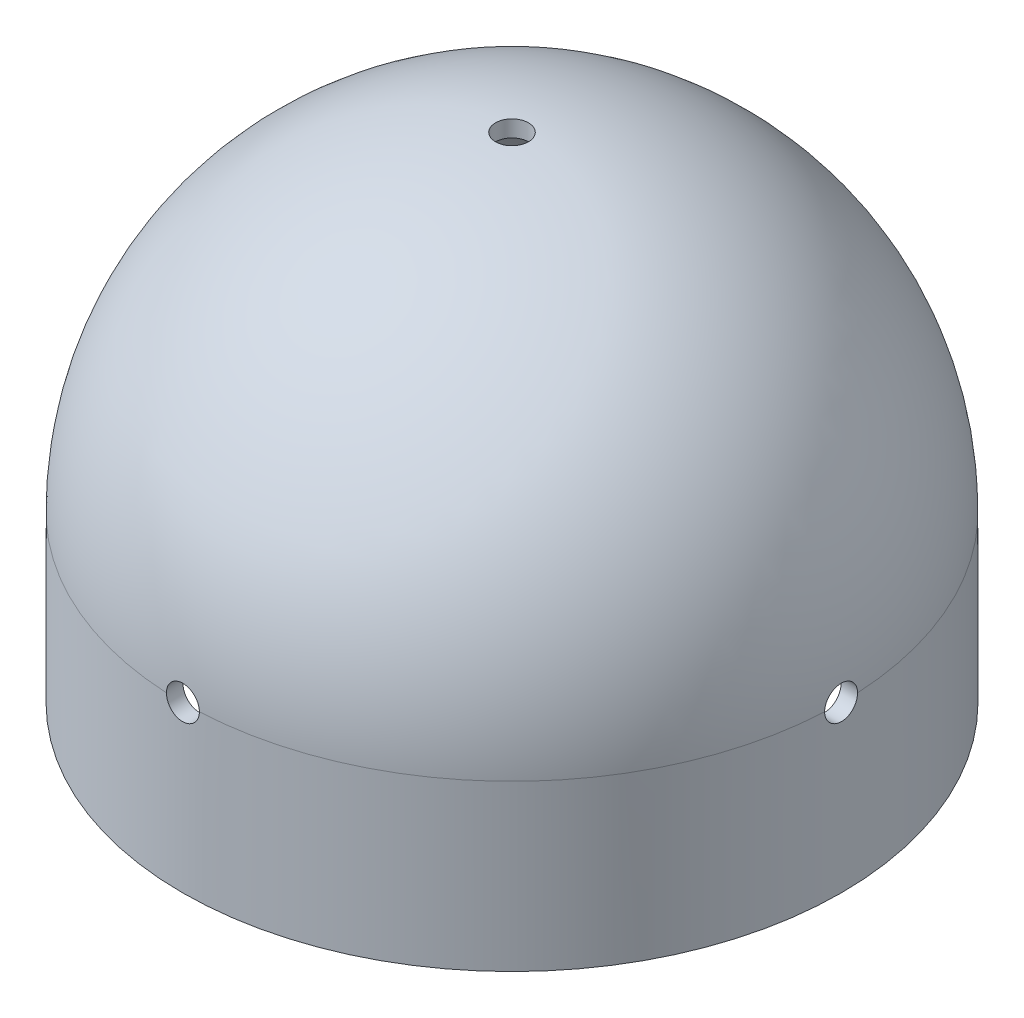
from build123d import *

# Parameters (mm, degrees)
SKETCH5_R          = 0.5
CUT_EXTRUDE1_DEPTH = 21.615528128
CIRPATTERN1_COUNT  = 4
SKETCH6_R          = 0.5
CUT_EXTRUDE2_DEPTH = 21.615528225


with BuildPart() as part:
    # Sketch1 → Revolve2 (revolve)
    with BuildSketch(Plane.XY):
        with BuildLine():
            Line((10, 5), (10, 0))
            Line((10, 0), (9.5, 0))
            Line((9.5, 0), (9.5, 5))
            ThreePointArc((9.5, 5), (6.717514421, 11.717514421), (0, 14.5))
            Line((0, 14.5), (0, 15))
            ThreePointArc((0, 15), (7.071067812, 12.071067812), (10, 5))
        make_face()
    revolve(axis=Axis((0, 0, 0), (0, 1, 0)))

    # Sketch5 → Cut-Extrude1 (cut, through all)
    with BuildSketch(Plane.XY):
        with Locations(Location((0, 5, 0), (0, 0, 180))):
            Circle(SKETCH5_R)
    cut_extrude1 = extrude(amount=CUT_EXTRUDE1_DEPTH, mode=Mode.SUBTRACT)

    # CirPattern1: Cut-Extrude1 ×4 about axis
    cirpattern1_axis = Axis((0, 0, 0), (0, -1, 0))
    for i in range(1, CIRPATTERN1_COUNT):
        add(cut_extrude1.rotate(cirpattern1_axis, i * 360 / CIRPATTERN1_COUNT), mode=Mode.SUBTRACT)

    # Sketch6 → Cut-Extrude2 (cut, through all)
    with BuildSketch(Plane(origin=(0, 0, 0), x_dir=(1, 0, 0), z_dir=(0, 1, 0))):
        with Locations(Location((0, 0, 0), (0, 0, 90))):
            Circle(SKETCH6_R)
    extrude(amount=CUT_EXTRUDE2_DEPTH, mode=Mode.SUBTRACT)


solid = part.part
